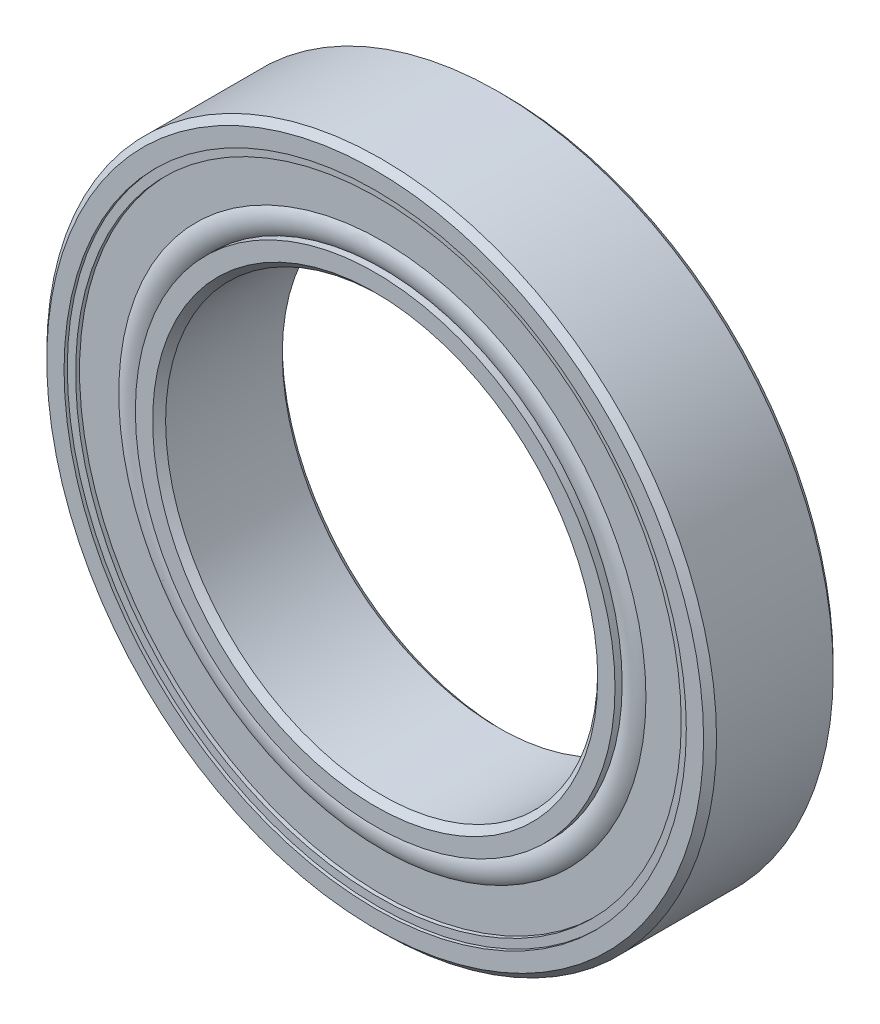
from build123d import *

# Parameters (mm, degrees)
CIRPATTERN1_COUNT = 11


with BuildPart() as part:
    # Sketch3 → Revolve1 (revolve)
    with BuildSketch(Plane(origin=(0, 0, 0), x_dir=(0, 0, -1), z_dir=(1, 0, 0)), mode=Mode.PRIVATE) as revolve1_sk:
        with BuildLine():
            Line((-6, 30.4), (-6, 28.79975))
            Line((-6, 28.79975), (-2.666666667, 28.79975))
            ThreePointArc((-2.666666667, 28.79975), (0, 29.742521631), (2.666666667, 28.79975))
            Line((2.666666667, 28.79975), (6, 28.79975))
            Line((6, 28.79975), (6, 30.4))
            Line((6, 30.4), (5.4, 31))
            Line((5.4, 31), (-5.4, 31))
            Line((-5.4, 31), (-6, 30.4))
        make_face()
        with BuildLine():
            Line((-6, 20.5995), (-6, 22.19975))
            Line((-6, 22.19975), (-2.666666667, 22.19975))
            ThreePointArc((-2.666666667, 22.19975), (0, 21.256978369), (2.666666667, 22.19975))
            Line((2.666666667, 22.19975), (6, 22.19975))
            Line((6, 22.19975), (6, 20.5995))
            Line((6, 20.5995), (5.4, 19.9995))
            Line((5.4, 19.9995), (-5.4, 19.9995))
            Line((-5.4, 19.9995), (-6, 20.5995))
        make_face()
    revolve(revolve1_sk.sketch.rotate(Axis((0, 0, 6), (0, 0, -1)), 90), axis=Axis((0, 0, 6), (0, 0, -1)))


with BuildPart() as body_2:
    # Sketch4 → Revolve2 (revolve)
    with BuildSketch(Plane(origin=(0, 0, 0), x_dir=(0, 0, -1), z_dir=(1, 0, 0))):
        with BuildLine():
            Line((-4.242771631, 25.49975), (4.242771631, 25.49975))
            ThreePointArc((4.242771631, 25.49975), (0, 29.742521631), (-4.242771631, 25.49975))
        make_face()
    revolve(axis=Axis((0, 25.49975, 4.242771631), (0, 0, -1)))


with BuildPart() as cirpattern1_1:
    # CirPattern1: pattern copy
    add(body_2.part.rotate(Axis((0, 0, 0), (0, 0, 1)), 1 * 360 / CIRPATTERN1_COUNT))


with BuildPart() as cirpattern1_2:
    # CirPattern1: pattern copy
    add(body_2.part.rotate(Axis((0, 0, 0), (0, 0, 1)), 2 * 360 / CIRPATTERN1_COUNT))


with BuildPart() as cirpattern1_3:
    # CirPattern1: pattern copy
    add(body_2.part.rotate(Axis((0, 0, 0), (0, 0, 1)), 3 * 360 / CIRPATTERN1_COUNT))


with BuildPart() as cirpattern1_4:
    # CirPattern1: pattern copy
    add(body_2.part.rotate(Axis((0, 0, 0), (0, 0, 1)), 4 * 360 / CIRPATTERN1_COUNT))


with BuildPart() as cirpattern1_5:
    # CirPattern1: pattern copy
    add(body_2.part.rotate(Axis((0, 0, 0), (0, 0, 1)), 5 * 360 / CIRPATTERN1_COUNT))


with BuildPart() as cirpattern1_6:
    # CirPattern1: pattern copy
    add(body_2.part.rotate(Axis((0, 0, 0), (0, 0, 1)), 6 * 360 / CIRPATTERN1_COUNT))


with BuildPart() as cirpattern1_7:
    # CirPattern1: pattern copy
    add(body_2.part.rotate(Axis((0, 0, 0), (0, 0, 1)), 7 * 360 / CIRPATTERN1_COUNT))


with BuildPart() as cirpattern1_8:
    # CirPattern1: pattern copy
    add(body_2.part.rotate(Axis((0, 0, 0), (0, 0, 1)), 8 * 360 / CIRPATTERN1_COUNT))


with BuildPart() as cirpattern1_9:
    # CirPattern1: pattern copy
    add(body_2.part.rotate(Axis((0, 0, 0), (0, 0, 1)), 9 * 360 / CIRPATTERN1_COUNT))


with BuildPart() as cirpattern1_10:
    # CirPattern1: pattern copy
    add(body_2.part.rotate(Axis((0, 0, 0), (0, 0, 1)), 10 * 360 / CIRPATTERN1_COUNT))


with BuildPart() as body_13:
    # Sketch5 → Revolve3 (revolve)
    with BuildSketch(Plane(origin=(0, 0, 0), x_dir=(0, 0, -1), z_dir=(1, 0, 0)), mode=Mode.PRIVATE) as revolve3_sk:
        with BuildLine():
            Line((-5.7, 28.79975), (-4.242771631, 28.79975))
            Line((-4.242771631, 28.79975), (-4.242771631, 22.19975))
            Line((-4.242771631, 22.19975), (-5.335692908, 22.19975))
            ThreePointArc((-5.335692908, 22.19975), (-5.7, 23.29975), (-5.335692908, 24.39975))
            Line((-5.335692908, 24.39975), (-5.335692908, 28.02975))
            Line((-5.335692908, 28.02975), (-5.7, 28.02975))
            Line((-5.7, 28.02975), (-5.7, 28.79975))
        make_face()
        with BuildLine():
            Line((5.335692908, 22.19975), (4.242771631, 22.19975))
            Line((4.242771631, 22.19975), (4.242771631, 28.79975))
            Line((4.242771631, 28.79975), (5.7, 28.79975))
            Line((5.7, 28.79975), (5.7, 28.02975))
            Line((5.7, 28.02975), (5.335692908, 28.02975))
            Line((5.335692908, 28.02975), (5.335692908, 24.39975))
            ThreePointArc((5.335692908, 24.39975), (5.7, 23.29975), (5.335692908, 22.19975))
        make_face()
    revolve(revolve3_sk.sketch.rotate(Axis((0, 0, 6), (0, 0, -1)), 90), axis=Axis((0, 0, 6), (0, 0, -1)))


solid = Compound([part.part, body_2.part, cirpattern1_1.part, cirpattern1_2.part, cirpattern1_3.part, cirpattern1_4.part, cirpattern1_5.part, cirpattern1_6.part, cirpattern1_7.part, cirpattern1_8.part, cirpattern1_9.part, cirpattern1_10.part, body_13.part])
